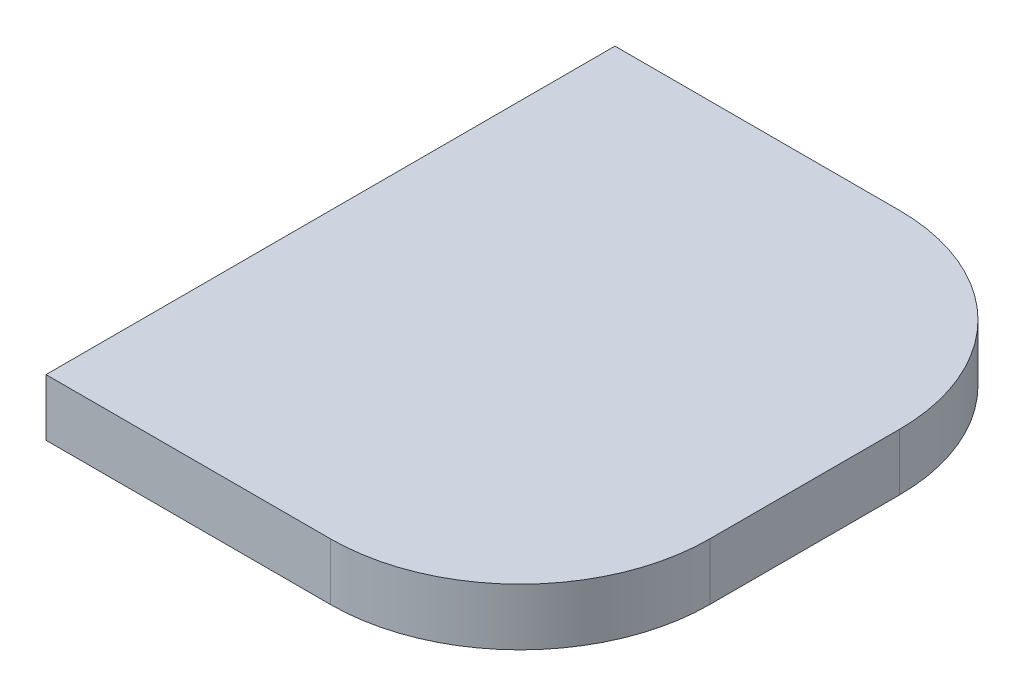
from build123d import *

# Parameters (mm, degrees)
BOSS_EXTRUDE1_DEPTH = 3


with BuildPart() as part:
    # Sketch1 → Boss-Extrude1 (new body)
    with BuildSketch(Plane(origin=(0, 0, 0), x_dir=(1, 0, 0), z_dir=(0, 1, 0))):
        with BuildLine():
            Line((2.5, -15), (-12.5, -15))
            Line((-12.5, -15), (-12.5, 15))
            Line((-12.5, 15), (2.5, 15))
            ThreePointArc((2.5, 15), (9.571067812, 12.071067812), (12.5, 5))
            Line((12.5, 5), (12.5, -5))
            ThreePointArc((12.5, -5), (9.571067812, -12.071067812), (2.5, -15))
        make_face()
    extrude(amount=BOSS_EXTRUDE1_DEPTH)


solid = part.part
